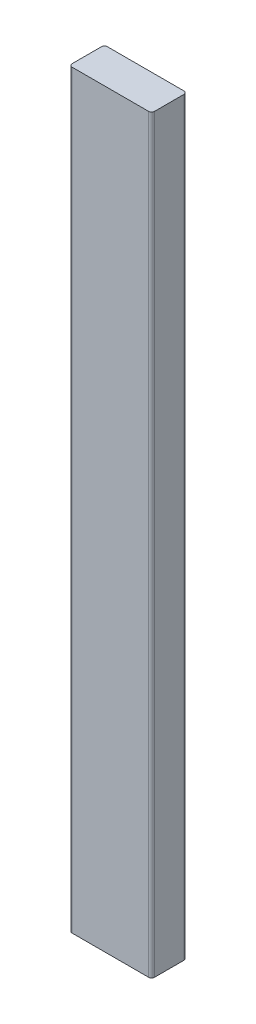
from build123d import *

# Parameters (mm, degrees)
SKETCH1_W           = 88.9
SKETCH1_H           = 38.1
BOSS_EXTRUDE1_DEPTH = 808.0375
FILLET1_R           = 3.175


with BuildPart() as part:
    # Sketch1 → Boss-Extrude1 (new body)
    with BuildSketch(Plane(origin=(0, 0, 0), x_dir=(1, 0, 0), z_dir=(0, 1, 0))):
        Rectangle(SKETCH1_W, SKETCH1_H)
    extrude(amount=BOSS_EXTRUDE1_DEPTH)

    # Fillet1
    fillet1_edges = [part.edges().sort_by_distance(p)[0] for p in [
        (-44.45, 404.01875, -19.05),
        (44.45, 404.01875, -19.05),
        (44.45, 404.01875, 19.05),
        (-44.45, 404.01875, 19.05),
    ]]
    fillet(fillet1_edges, radius=FILLET1_R)


solid = part.part
